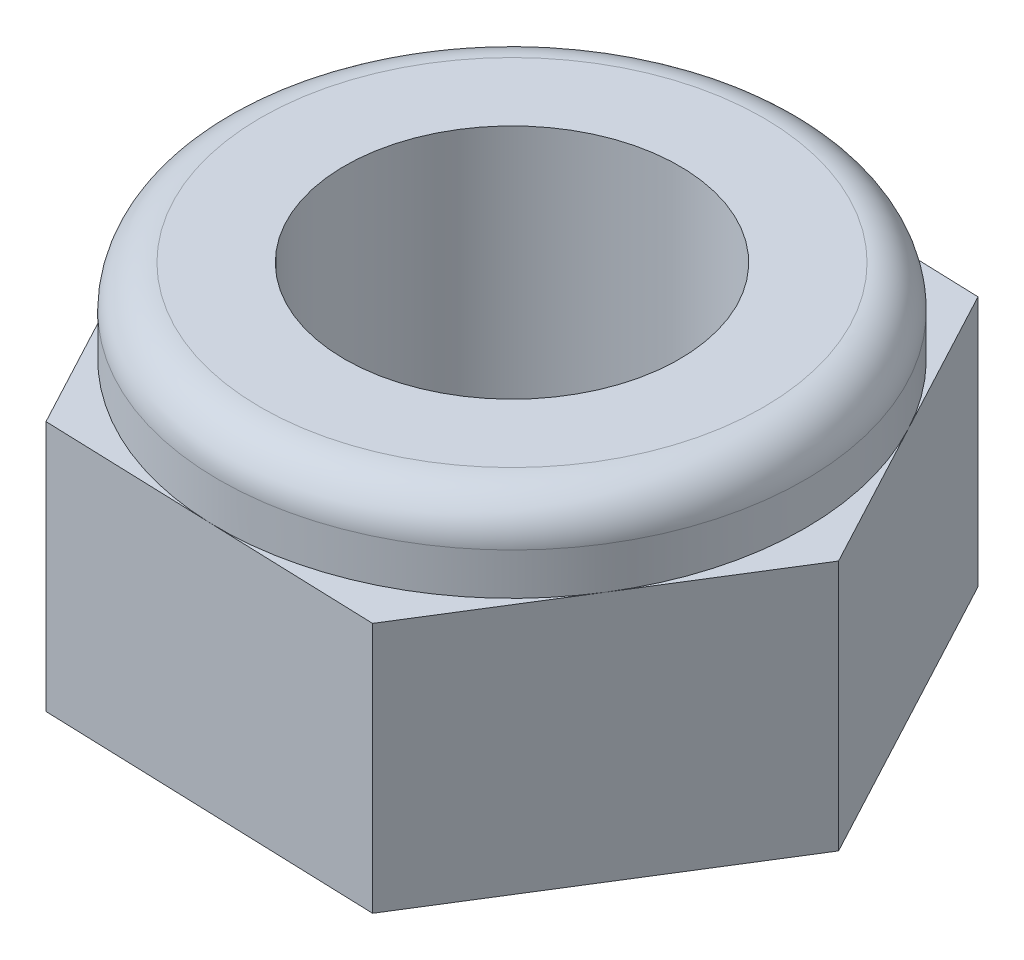
from build123d import *

# Parameters (mm, degrees)
EXTRUDE_1_DEPTH     = 3
SKETCH_2_R          = 3.5
EXTRUDE_2_DEPTH     = 1
SKETCH_4_R          = 2
CUT_EXTRUDE_1_DEPTH = 7.710820383
FILLET_1_R          = 0.5


with BuildPart() as part:
    # 草图1 → 凸台-拉伸1 (new body)
    with BuildSketch(Plane(origin=(0, 0, 0), x_dir=(1, 0, 0), z_dir=(0, 1, 0))):
        Polygon((2.138404501, 3.429367219), (-1.90071688, 3.566596231), (-4.039121381, 0.137229012), (-2.138404501, -3.429367219), (1.90071688, -3.566596231), (4.039121381, -0.137229012), align=None)
    extrude(amount=EXTRUDE_1_DEPTH)

    # 草图2 → 凸台-拉伸2 (add)
    with BuildSketch(Plane(origin=(0, 3, 0), x_dir=(1, 0, 0), z_dir=(0, 1, 0))):
        with Locations(Location((0, 0, 0), (0, 0, 88.054126305))):
            Circle(SKETCH_2_R)
    extrude(amount=EXTRUDE_2_DEPTH)

    # 草图4 → 切除-拉伸1 (cut, through all)
    with BuildSketch(Plane(origin=(0, 4, 0), x_dir=(1, 0, 0), z_dir=(0, 1, 0))):
        with Locations(Location((0, 0, 0), (0, 0, 270))):
            Circle(SKETCH_4_R)
    extrude(amount=-CUT_EXTRUDE_1_DEPTH, mode=Mode.SUBTRACT)

    # 圆角1
    fillet_1_edges = [part.edges().sort_by_distance(p)[0] for p in [
        (-0.118843811, 4, 3.497981725),
    ]]
    fillet(fillet_1_edges, radius=FILLET_1_R)


solid = part.part
